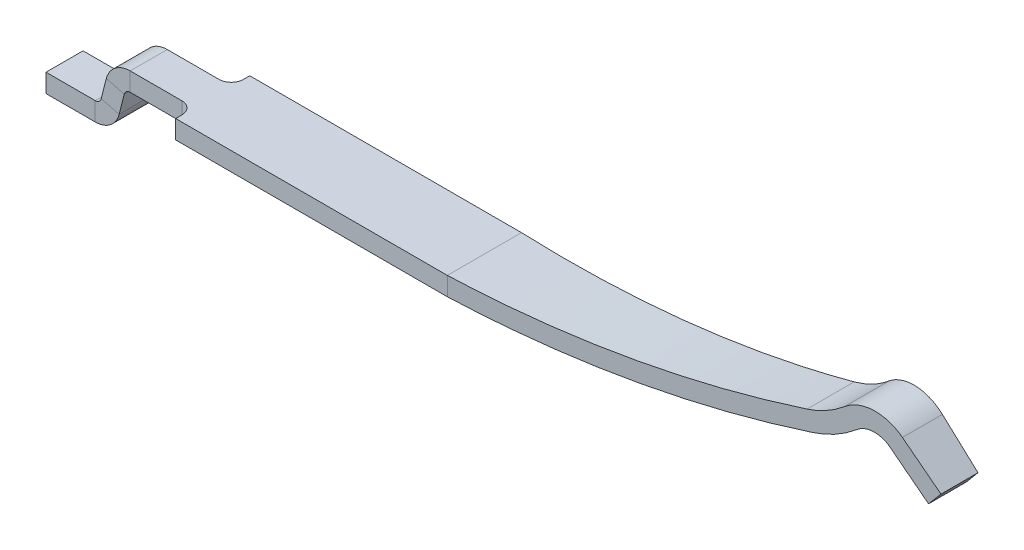
from build123d import *

# Parameters (mm, degrees)
SKETCH1_W           = 0.6
SKETCH1_H           = 0.15
BOSS_EXTRUDE1_DEPTH = 1.7
SKETCH3_W           = 0.3
SKETCH3_H           = 0.15
FILLET1_R           = 0.1
SKETCH6_W           = 0.6
SKETCH6_H           = 0.15
SKETCH8_OUTSIDE_W   = 10.719
SKETCH8_OUTSIDE_H   = 4.072
CUT_EXTRUDE2_DEPTH  = 7.162375815


with BuildPart() as part:
    # Sketch1 → Boss-Extrude1 (new body)
    with BuildSketch(Plane(origin=(0, 0, 0), x_dir=(0, 0, -1), z_dir=(1, 0, 0))):
        with Locations((0, 0.425)):
            Rectangle(SKETCH1_W, SKETCH1_H)
    extrude(amount=BOSS_EXTRUDE1_DEPTH)

    # Sweep1: sweep along a path in Sketch4
    with BuildLine(Plane.XY) as sweep1_path:
        Line((-1.2, 0), (-0.801686668, 0))
        ThreePointArc((-0.801686668, 0), (-0.679081123, 0.041987722), (-0.607954852, 0.150321198))
        Line((-0.607954852, 0.150321198), (-0.566387806, 0.3124197))
        ThreePointArc((-0.566387806, 0.3124197), (-0.548606238, 0.33950307), (-0.517954852, 0.35))
        Line((-0.517954852, 0.35), (0, 0.35))
    # Sketch3 → Sweep1 (sweep)
    with BuildSketch(Plane(origin=(-1.2, 0, 0), x_dir=(0, 0, -1), z_dir=(1, 0, 0))):
        with Locations((0, 0.075)):
            Rectangle(SKETCH3_W, SKETCH3_H)
    sweep(path=sweep1_path.line)

    # Fillet1
    fillet1_edges = [part.edges().sort_by_distance(p)[0] for p in [
        (0, 0.425, -0.15),
        (0, 0.425, 0.15),
    ]]
    fillet(fillet1_edges, radius=FILLET1_R)

    # Sweep2: sweep along a path in Sketch5
    with BuildLine(Plane.XY) as sweep2_path:
        Line((1.7, 0.35), (2.2, 0.35))
        ThreePointArc((2.2, 0.35), (3.63833241, 0.454572769), (5.046413219, 0.76609166))
        ThreePointArc((5.046413219, 0.76609166), (5.228907253, 0.84171313), (5.392178582, 0.952911835))
        ThreePointArc((5.392178582, 0.952911835), (5.521089291, 1), (5.65, 0.952911835))
        Line((5.65, 0.952911835), (5.95, 0.7))
    # Sketch6 → Sweep2 (sweep)
    with BuildSketch(Plane(origin=(1.7, 0, 0), x_dir=(0, 0, -1), z_dir=(1, 0, 0))):
        with Locations((0, 0.425)):
            Rectangle(SKETCH6_W, SKETCH6_H)
    sweep(path=sweep2_path.line)

    # Sketch8 outside → Cut-Extrude2 (cut, through all)
    with BuildSketch(Plane(origin=(0, 0, 0), x_dir=(1, 0, 0), z_dir=(0, 1, 0))):
        with Locations((2.4235, 0)):
            Rectangle(SKETCH8_OUTSIDE_W, SKETCH8_OUTSIDE_H)
        Polygon((-1.2, 0.432581758), (6.046683032, 0.15), (6.046683032, -0.15), (-1.2, -0.432581758), align=None, mode=Mode.SUBTRACT)
    extrude(amount=CUT_EXTRUDE2_DEPTH, mode=Mode.SUBTRACT)


solid = part.part
